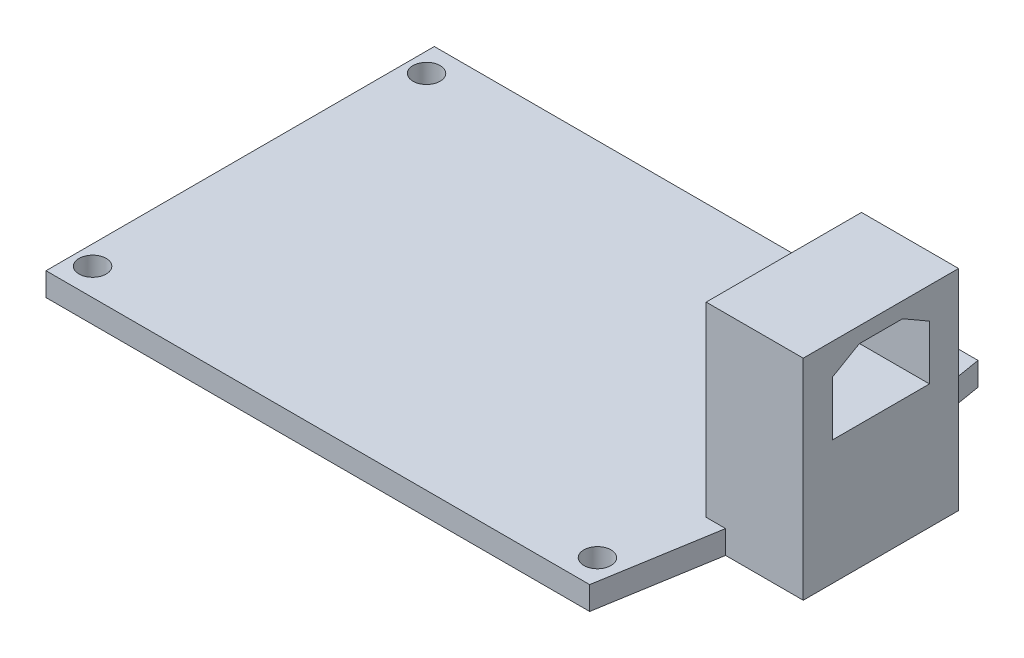
from build123d import *

# Parameters (mm, degrees)
SKETCH1_W                                  = 70
SKETCH1_H                                  = 50
BOSS_EXTRUDE1_DEPTH                        = 3
SKETCH2_R                                  = 1.75
CUT_EXTRUDE1_DEPTH                         = 10
MIRROR1_AT_THE_SECOND_PLANE_COPY_1_SKETC_R = 1.75
MIRROR1_AT_THE_SECOND_PLANE_COPY_1_DEPTH   = 10
SKETCH4_W                                  = 2.5
SKETCH4_H                                  = 10
BOSS_EXTRUDE2_DEPTH                        = 28
BOSS_EXTRUDE3_DEPTH                        = 3
CUT_EXTRUDE2_DEPTH                         = 3
BOSS_EXTRUDE4_DEPTH                        = 10
BOSS_EXTRUDE5_DEPTH                        = 10
SKETCH11_W                                 = 20
SKETCH11_H                                 = 1
CUT_EXTRUDE3_DEPTH                         = 10


with BuildPart() as part:
    # Sketch1 → Boss-Extrude1 (new body)
    with BuildSketch(Plane(origin=(0, 0, 0), x_dir=(1, 0, 0), z_dir=(0, 1, 0))):
        Rectangle(SKETCH1_W, SKETCH1_H)
    extrude(amount=BOSS_EXTRUDE1_DEPTH)

    # Sketch2 → Cut-Extrude1 (cut)
    with BuildSketch(Plane(origin=(0, 3, 0), x_dir=(1, 0, 0), z_dir=(0, 1, 0))):
        with Locations(Location((32.5, -21.5, 0), (0, 0, 270))):
            Circle(SKETCH2_R)
    cut_extrude1 = extrude(amount=-CUT_EXTRUDE1_DEPTH, mode=Mode.SUBTRACT)

    # Mirror1: Cut-Extrude1 across plane
    add(cut_extrude1.mirror(Plane.XY), mode=Mode.SUBTRACT)

    # Mirror1 at the second plane: Cut-Extrude1 across plane
    add(cut_extrude1.mirror(Plane(origin=(0, 0, 0), x_dir=(0, 0, 1), z_dir=(1, 0, 0))), mode=Mode.SUBTRACT)

    # Mirror1 at the second plane copy 1 sketc → Mirror1 at the second plane copy 1 (cut)
    with BuildSketch(Plane(origin=(0, 3, 0), x_dir=(-1, 0, 0), z_dir=(0, 1, 0))):
        with Locations(Location((32.5, -21.5, 0), (0, 0, 270))):
            Circle(MIRROR1_AT_THE_SECOND_PLANE_COPY_1_SKETC_R)
    extrude(amount=-MIRROR1_AT_THE_SECOND_PLANE_COPY_1_DEPTH, mode=Mode.SUBTRACT)

    # Sketch4 → Boss-Extrude2 (add)
    with BuildSketch(Plane(origin=(0, 0, 0), x_dir=(1, 0, 0), z_dir=(0, 1, 0))):
        with Locations((36.25, -5)):
            Rectangle(SKETCH4_W, SKETCH4_H)
        with Locations((36.25, 5)):
            Rectangle(SKETCH4_W, SKETCH4_H)
    extrude(amount=BOSS_EXTRUDE2_DEPTH)

    # Sketch7 → Boss-Extrude3 (add)
    with BuildSketch(Plane(origin=(0, 3, 0), x_dir=(1, 0, 0), z_dir=(0, 1, 0))):
        Polygon((35, -10), (35, -25), (37.5, -10), align=None)
    boss_extrude3 = extrude(amount=-BOSS_EXTRUDE3_DEPTH)

    # Mirror2: Boss-Extrude3 across plane
    add(boss_extrude3.mirror(Plane.XY))

    # Sketch8 → Cut-Extrude2 (cut)
    with BuildSketch(Plane(origin=(37.5, 0, 0), x_dir=(0, 0, -1), z_dir=(1, 0, 0))):
        Polygon((-2.785898385, 25), (-6.25, 23), (-6.25, 16), (6.25, 16), (6.25, 23), (2.785898385, 25), align=None)
    extrude(amount=-CUT_EXTRUDE2_DEPTH, mode=Mode.SUBTRACT)

    # Sketch9 → Boss-Extrude4 (add)
    with BuildSketch(Plane(origin=(37.5, 0, 0), x_dir=(0, 0, -1), z_dir=(1, 0, 0))):
        Polygon((-6.75, 15.5), (6.75, 15.5), (6.75, 23.288675135), (2.919872981, 25.5), (-2.919872981, 25.5), (-6.75, 23.288675135), align=None)
        Polygon((-6.25, 23), (-6.25, 16), (6.25, 16), (6.25, 23), (2.785898385, 25), (-2.785898385, 25), align=None, mode=Mode.SUBTRACT)
    extrude(amount=BOSS_EXTRUDE4_DEPTH)

    # Sketch10 → Boss-Extrude5 (add)
    with BuildSketch(Plane(origin=(37.5, 0, 0), x_dir=(0, 0, -1), z_dir=(1, 0, 0))):
        Polygon((10, 27), (-10, 27), (-10, 3), (-10, 0), (10, 0), (10, 3), align=None)
        Polygon((-6.75, 15.5), (-6.75, 23.288675135), (-2.919872981, 25.5), (2.919872981, 25.5), (6.75, 23.288675135), (6.75, 15.5), align=None, mode=Mode.SUBTRACT)
    extrude(amount=BOSS_EXTRUDE5_DEPTH)

    # Sketch11 → Cut-Extrude3 (cut)
    with BuildSketch(Plane(origin=(37.5, 0, 0), x_dir=(0, 0, -1), z_dir=(1, 0, 0))):
        with Locations((0, 27.5)):
            Rectangle(SKETCH11_W, SKETCH11_H)
    extrude(amount=-CUT_EXTRUDE3_DEPTH, mode=Mode.SUBTRACT)


solid = part.part
